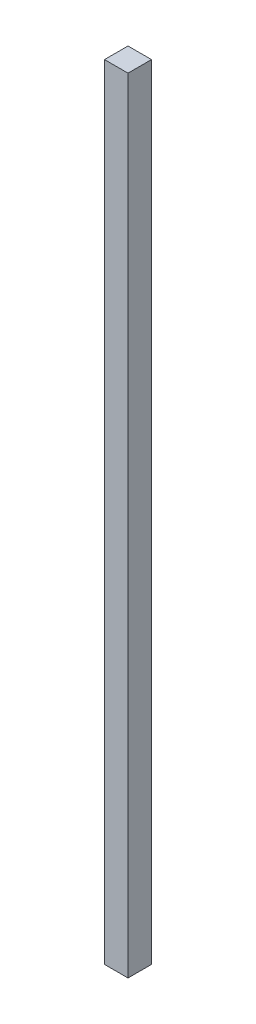
from build123d import *

# Parameters (mm, degrees)
SKETCH1_W           = 30
SKETCH1_H           = 30
BOSS_EXTRUDE1_DEPTH = 1000


with BuildPart() as part:
    # Sketch1 → Boss-Extrude1 (new body)
    with BuildSketch(Plane(origin=(0, 0, 0), x_dir=(1, 0, 0), z_dir=(0, 1, 0))):
        Rectangle(SKETCH1_W, SKETCH1_H)
    extrude(amount=BOSS_EXTRUDE1_DEPTH)


solid = part.part
